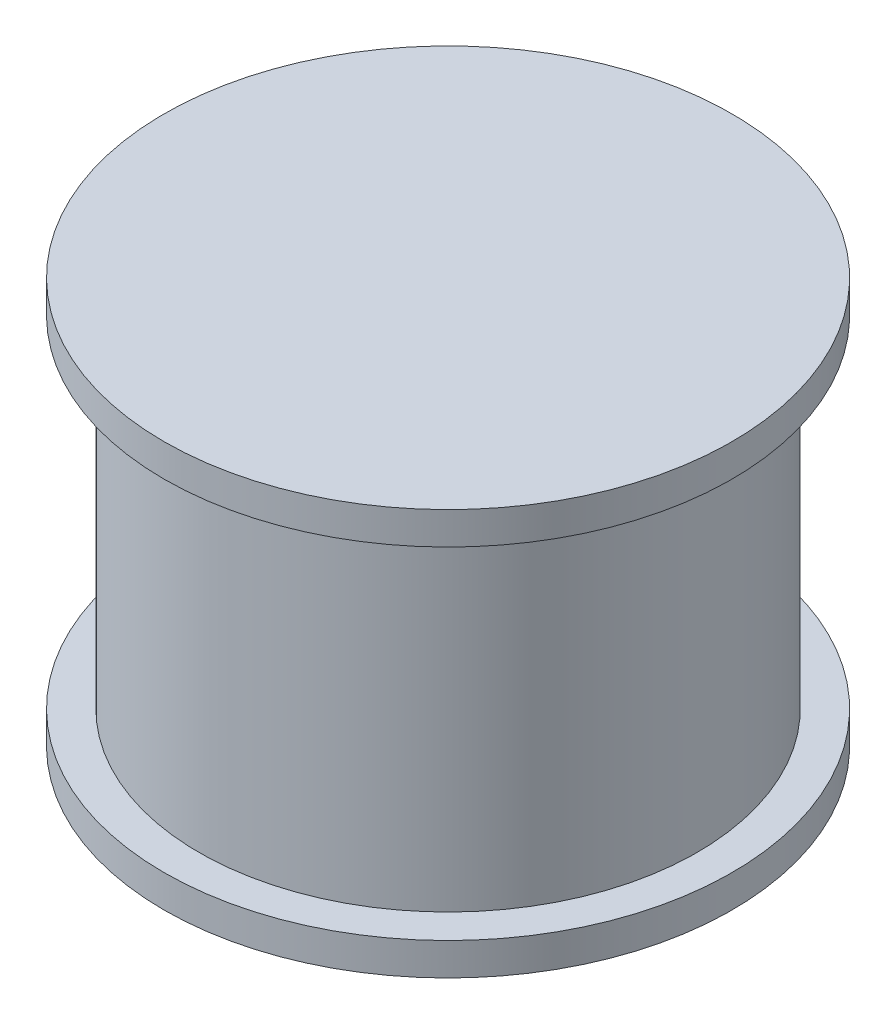
from build123d import *

# Parameters (mm, degrees)
SKETCH_1_R      = 15.35
EXTRUDE_1_DEPTH = 10.5
SKETCH_2_R      = 17.5
EXTRUDE_2_DEPTH = 2


with BuildPart() as part:
    # 草图1 → 凸台-拉伸1 (new, symmetric)
    with BuildSketch(Plane(origin=(0, 0, 0), x_dir=(1, 0, 0), z_dir=(0, 1, 0))):
        with Locations(Location((0, 0, 0), (0, 0, 90))):
            Circle(SKETCH_1_R)
    extrude(amount=EXTRUDE_1_DEPTH, both=True)

    # 草图2 → 凸台-拉伸2 (add)
    with BuildSketch(Plane(origin=(0, 10.5, 0), x_dir=(1, 0, 0), z_dir=(0, 1, 0))):
        with Locations(Location((0, 0, 0), (0, 0, 270))):
            Circle(SKETCH_2_R)
    extrude_2 = extrude(amount=EXTRUDE_2_DEPTH)

    # 镜向1: 凸台-拉伸2 across plane
    add(extrude_2.mirror(Plane.ZX))


solid = part.part
